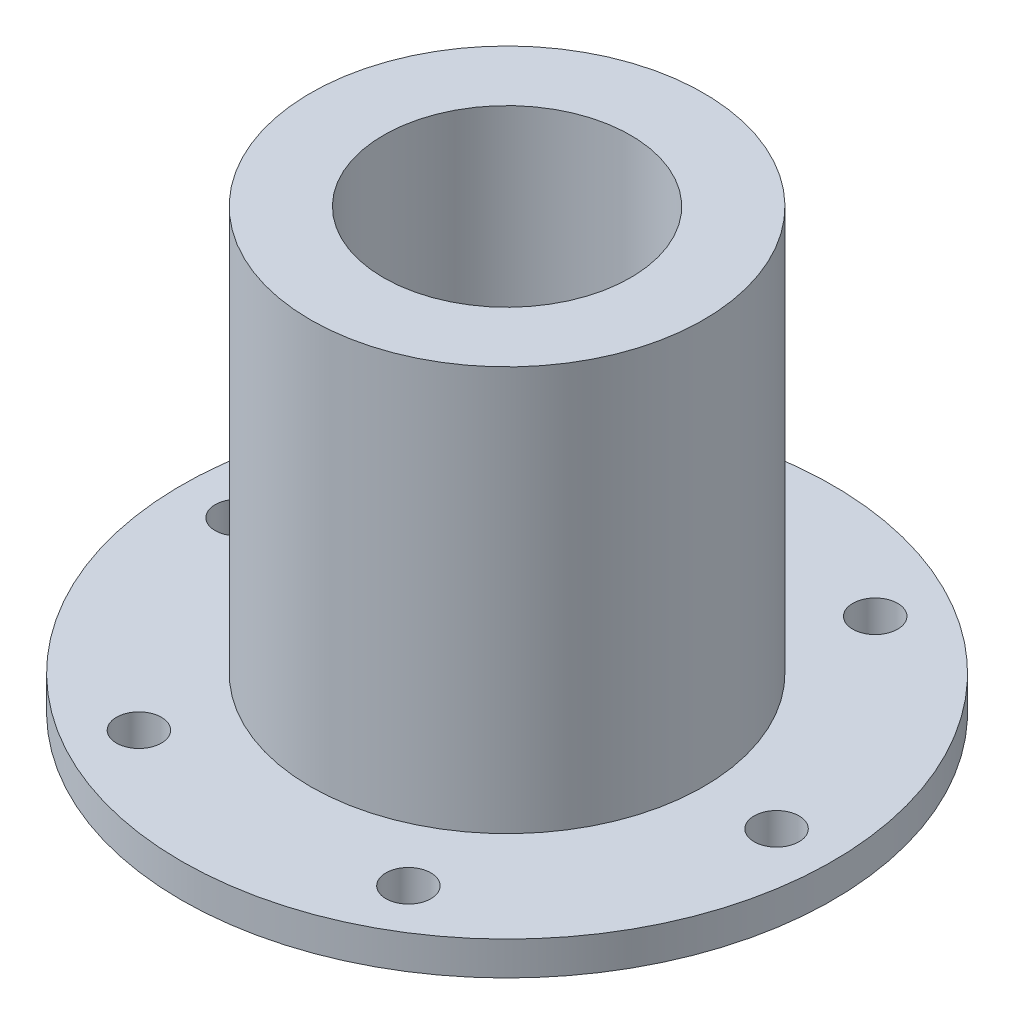
from build123d import *

# Parameters (mm, degrees)
SKETCH_1_R          = 29
EXTRUDE_1_DEPTH     = 3
SKETCH_3_R          = 17.5
EXTRUDE_2_DEPTH     = 36
SKETCH_4_R          = 11
CUT_EXTRUDE_2_DEPTH = 57.595052787
SKETCH_5_R          = 2
CUT_EXTRUDE_3_DEPTH = 10


with BuildPart() as part:
    # 草图1 → 凸台-拉伸1 (new body)
    with BuildSketch(Plane(origin=(0, 0, 0), x_dir=(1, 0, 0), z_dir=(0, 1, 0))):
        with Locations(Location((0, 0, 0), (0, 0, 270))):
            Circle(SKETCH_1_R)
    extrude(amount=EXTRUDE_1_DEPTH)

    # 草图3 → 凸台-拉伸2 (add)
    with BuildSketch(Plane(origin=(0, 3, 0), x_dir=(1, 0, 0), z_dir=(0, 1, 0))):
        with Locations(Location((0, 0, 0), (0, 0, 270))):
            Circle(SKETCH_3_R)
    extrude(amount=EXTRUDE_2_DEPTH)

    # 草图4 → 切除-拉伸2 (cut, through all)
    with BuildSketch(Plane(origin=(0, 39, 0), x_dir=(1, 0, 0), z_dir=(0, 1, 0))):
        with Locations(Location((0, 0, 0), (0, 0, 270))):
            Circle(SKETCH_4_R)
    extrude(amount=-CUT_EXTRUDE_2_DEPTH, mode=Mode.SUBTRACT)

    # 草图5 → 切除-拉伸3 (cut)
    with BuildSketch(Plane(origin=(0, 3, 0), x_dir=(1, 0, 0), z_dir=(0, 1, 0))):
        with Locations(Location((24, 0, 0), (0, 0, 270))):
            Circle(SKETCH_5_R)
        with Locations(Location((12, -20.784609691, 0), (0, 0, 270))):
            Circle(SKETCH_5_R)
        with Locations(Location((-12, -20.784609691, 0), (0, 0, 270))):
            Circle(SKETCH_5_R)
        with Locations(Location((-24, 0, 0), (0, 0, 270))):
            Circle(SKETCH_5_R)
        with Locations(Location((-12, 20.784609691, 0), (0, 0, 270))):
            Circle(SKETCH_5_R)
        with Locations(Location((12, 20.784609691, 0), (0, 0, 270))):
            Circle(SKETCH_5_R)
    extrude(amount=-CUT_EXTRUDE_3_DEPTH, mode=Mode.SUBTRACT)


solid = part.part
